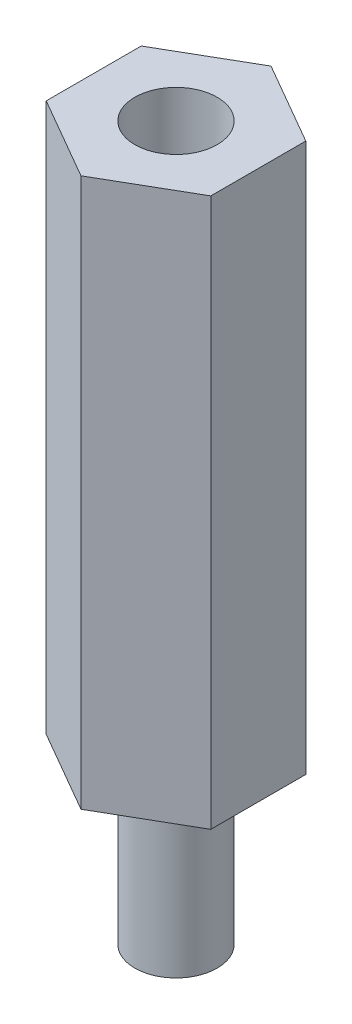
from build123d import *

# Parameters (mm, degrees)
SKETCH1_R           = 1.5
BOSS_EXTRUDE1_DEPTH = 6
BOSS_EXTRUDE2_DEPTH = 20
CUT_EXTRUDE1_START  = -6
SKETCH3_R           = 1.5
CUT_EXTRUDE1_DEPTH  = 6


with BuildPart() as part:
    # Sketch1 → Boss-Extrude1 (new body)
    with BuildSketch(Plane(origin=(0, 0, 0), x_dir=(1, 0, 0), z_dir=(0, 1, 0))):
        with Locations(Location((0, 0, 0), (0, 0, 270))):
            Circle(SKETCH1_R)
    extrude(amount=BOSS_EXTRUDE1_DEPTH)

    # Sketch2 → Boss-Extrude2 (add)
    with BuildSketch(Plane(origin=(0, 6, 0), x_dir=(1, 0, 0), z_dir=(0, 1, 0))):
        Polygon((-3, -1.732050808), (0, -3.464101615), (3, -1.732050808), (3, 1.732050808), (0, 3.464101615), (-3, 1.732050808), align=None)
    extrude(amount=BOSS_EXTRUDE2_DEPTH)

    # Sketch3 → Cut-Extrude1 (cut)
    with BuildSketch(Plane(origin=(0, 26, 0), x_dir=(1, 0, 0), z_dir=(0, 1, 0)).offset(CUT_EXTRUDE1_START)):
        with Locations(Location((0, 0, 0), (0, 0, 270))):
            Circle(SKETCH3_R)
    extrude(amount=CUT_EXTRUDE1_DEPTH, mode=Mode.SUBTRACT)


solid = part.part
